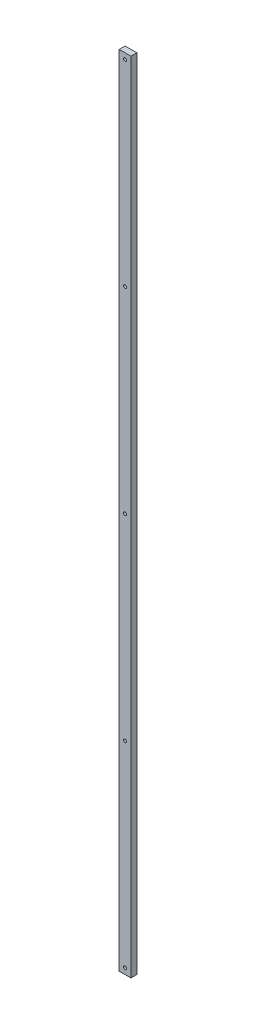
from build123d import *

# Parameters (mm, degrees)
SKETCH1_W           = 25.4
SKETCH1_H           = 1727.2
BOSS_EXTRUDE1_DEPTH = 12.7
SKETCH2_R           = 3.3655
CUT_EXTRUDE1_DEPTH  = 1728.433440107
LPATTERN1_COUNT     = 5
LPATTERN1_PITCH     = 425.45


with BuildPart() as part:
    # Sketch1 → Boss-Extrude1 (new body)
    with BuildSketch(Plane.XY):
        with Locations((12.7, 863.6)):
            Rectangle(SKETCH1_W, SKETCH1_H)
    extrude(amount=BOSS_EXTRUDE1_DEPTH)

    # Sketch2 → Cut-Extrude1 (cut, through all)
    with BuildSketch(Plane.XY.offset(12.7)):
        with Locations((12.7, 12.7)):
            Circle(SKETCH2_R)
    cut_extrude1 = extrude(amount=-CUT_EXTRUDE1_DEPTH, mode=Mode.SUBTRACT)

    # LPattern1: Cut-Extrude1 ×5
    with Locations(*[(0, i * LPATTERN1_PITCH, 0) for i in range(1, LPATTERN1_COUNT)]):
        add(cut_extrude1, mode=Mode.SUBTRACT)


solid = part.part
